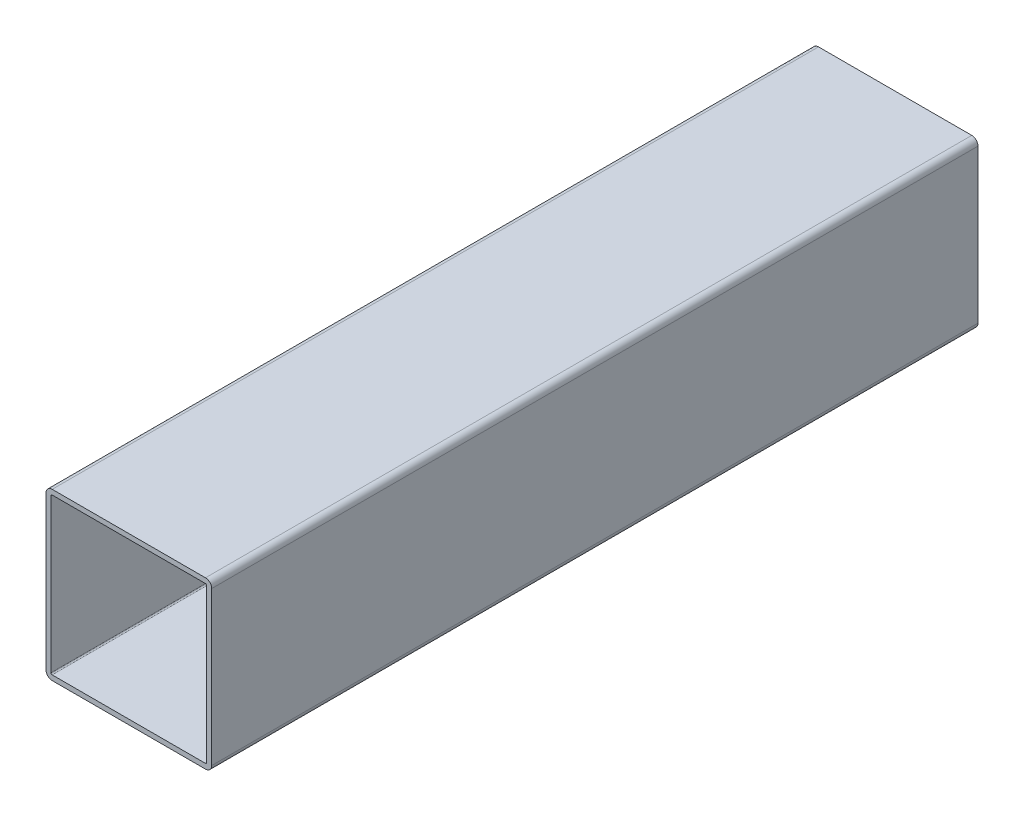
from build123d import *

# Parameters (mm, degrees)
STRUCTURAL_MEMBER1_DEPTH = 185


with BuildPart() as part:
    # Sketch12 → Structural Member1 (new body)
    with BuildSketch(Plane(origin=(0, 0, 0), x_dir=(-1, 0, 0), z_dir=(0, 0, -1))):
        with BuildLine():
            Line((-18.5, -20), (18.5, -20))
            ThreePointArc((18.5, -20), (19.560660172, -19.560660172), (20, -18.5))
            Line((20, -18.5), (20, 18.5))
            ThreePointArc((20, 18.5), (19.560660172, 19.560660172), (18.5, 20))
            Line((18.5, 20), (-18.5, 20))
            ThreePointArc((-18.5, 20), (-19.560660172, 19.560660172), (-20, 18.5))
            Line((-20, 18.5), (-20, -18.5))
            ThreePointArc((-20, -18.5), (-19.560660172, -19.560660172), (-18.5, -20))
        make_face()
        with BuildLine():
            Line((-18.5, -18.8), (18.5, -18.8))
            ThreePointArc((18.5, -18.8), (18.712132034, -18.712132034), (18.8, -18.5))
            Line((18.8, -18.5), (18.8, 18.5))
            ThreePointArc((18.8, 18.5), (18.712132034, 18.712132034), (18.5, 18.8))
            Line((18.5, 18.8), (-18.5, 18.8))
            ThreePointArc((-18.5, 18.8), (-18.712132034, 18.712132034), (-18.8, 18.5))
            Line((-18.8, 18.5), (-18.8, -18.5))
            ThreePointArc((-18.8, -18.5), (-18.712132034, -18.712132034), (-18.5, -18.8))
        make_face(mode=Mode.SUBTRACT)
    extrude(amount=STRUCTURAL_MEMBER1_DEPTH)


solid = part.part
